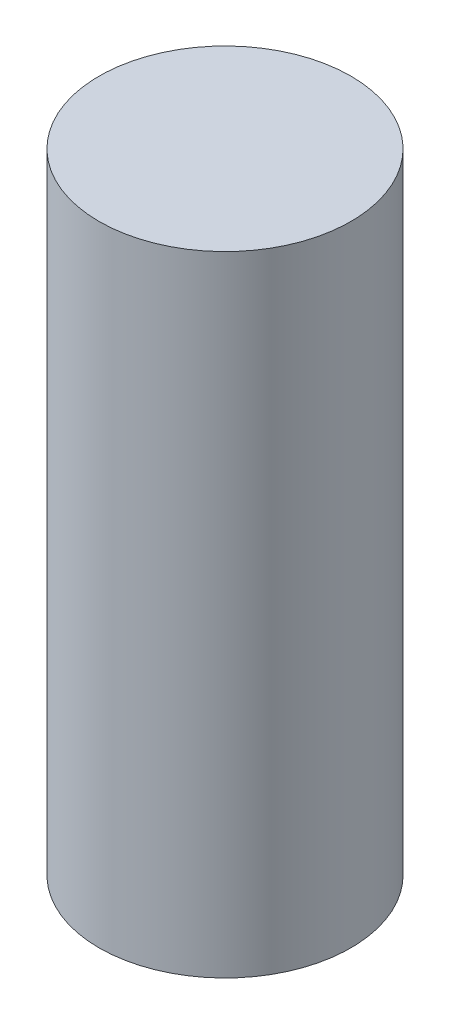
from build123d import *

# Parameters (mm, degrees)
SKETCH1_R           = 50.8381
BOSS_EXTRUDE1_DEPTH = 254


with BuildPart() as part:
    # Sketch1 → Boss-Extrude1 (new body)
    with BuildSketch(Plane(origin=(0, 0, 0), x_dir=(1, 0, 0), z_dir=(0, 1, 0))):
        with Locations(Location((0, 0, 0), (0, 0, 270))):
            Circle(SKETCH1_R)
    extrude(amount=BOSS_EXTRUDE1_DEPTH)


solid = part.part
